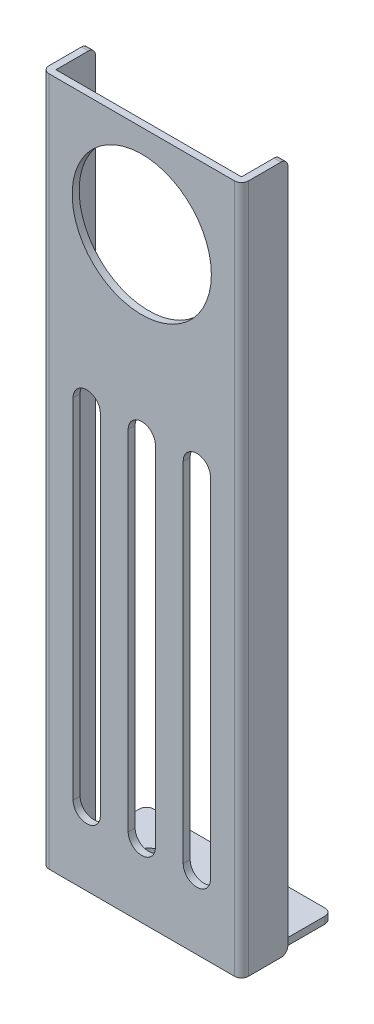
from build123d import *

# Parameters (mm, degrees)
CROQUIS1_W              = 40
CROQUIS1_H              = 148.5
SALIENTE_EXTRUIR1_DEPTH = 1.5
CROQUIS2_R              = 15
CORTAR_EXTRUIR1_DEPTH   = 1.5
CORTAR_EXTRUIR2_DEPTH   = 1.5
CROQUIS4_W              = 10
CROQUIS4_H              = 148.5
SALIENTE_EXTRUIR2_DEPTH = 1.5
CROQUIS5_W              = 10
CROQUIS5_H              = 148.5
SALIENTE_EXTRUIR3_DEPTH = 1.5
REDONDEO1_R             = 1.5
CROQUIS7_W              = 40
CROQUIS7_H              = 21
SALIENTE_EXTRUIR4_DEPTH = 1.5
REDONDEO2_R             = 1.5
CROQUIS8_R              = 2.75
CORTAR_EXTRUIR3_DEPTH   = 1.5
REDONDEO4_R             = 1.5


with BuildPart() as part:
    # Croquis1 → Saliente-Extruir1 (new body)
    with BuildSketch(Plane.XY):
        with Locations((-32.303310274, 45.797728257)):
            Rectangle(CROQUIS1_W, CROQUIS1_H)
    extrude(amount=SALIENTE_EXTRUIR1_DEPTH)

    # Croquis2 → Cortar-Extruir1 (cut)
    with BuildSketch(Plane.XY.offset(1.5)):
        with Locations((-32.303310274, 100.047728257)):
            Circle(CROQUIS2_R)
    extrude(amount=-CORTAR_EXTRUIR1_DEPTH, mode=Mode.SUBTRACT)

    # Croquis3 → Cortar-Extruir2 (cut)
    with BuildSketch(Plane.XY.offset(1.5)):
        with BuildLine():
            Line((-41.236643608, -12.952271743), (-41.236643608, 62.177728257))
            ThreePointArc((-41.236643608, 62.177728257), (-44.169976941, 65.11106159), (-47.103310274, 62.177728257))
            Line((-47.103310274, 62.177728257), (-47.103310274, -12.952271743))
            ThreePointArc((-47.103310274, -12.952271743), (-44.169976941, -15.885605076), (-41.236643608, -12.952271743))
        make_face()
        with BuildLine():
            Line((-29.369976941, -12.952271743), (-29.369976941, 62.177728257))
            ThreePointArc((-29.369976941, 62.177728257), (-32.303310274, 65.11106159), (-35.236643608, 62.177728257))
            Line((-35.236643608, 62.177728257), (-35.236643608, -12.952271743))
            ThreePointArc((-35.236643608, -12.952271743), (-32.303310274, -15.885605076), (-29.369976941, -12.952271743))
        make_face()
        with BuildLine():
            Line((-17.503310274, 62.177728257), (-17.503310274, -12.952271743))
            ThreePointArc((-17.503310274, -12.952271743), (-20.436643608, -15.885605076), (-23.369976941, -12.952271743))
            Line((-23.369976941, -12.952271743), (-23.369976941, 62.177728257))
            ThreePointArc((-23.369976941, 62.177728257), (-20.436643608, 65.11106159), (-17.503310274, 62.177728257))
        make_face()
    extrude(amount=-CORTAR_EXTRUIR2_DEPTH, mode=Mode.SUBTRACT)

    # Croquis4 → Saliente-Extruir2 (add)
    with BuildSketch(Plane.ZY.offset(52.303310274)):
        with Locations((-3.5, 45.797728257)):
            Rectangle(CROQUIS4_W, CROQUIS4_H)
    extrude(amount=SALIENTE_EXTRUIR2_DEPTH)

    # Croquis5 → Saliente-Extruir3 (add)
    with BuildSketch(Plane(origin=(-12.303310274, 0, 0), x_dir=(0, 0, -1), z_dir=(1, 0, 0))):
        with Locations((3.5, 45.797728257)):
            Rectangle(CROQUIS5_W, CROQUIS5_H)
    extrude(amount=SALIENTE_EXTRUIR3_DEPTH)

    # Redondeo1
    redondeo1_edges = [part.edges().sort_by_distance(p)[0] for p in [
        (-53.803310274, 45.797728257, 1.5),
        (-10.803310274, 45.797728257, 1.5),
    ]]
    fillet(redondeo1_edges, radius=REDONDEO1_R)

    # Croquis7 → Saliente-Extruir4 (add)
    with BuildSketch(Plane.XZ.offset(28.452271743)):
        with Locations((-32.303310274, -9)):
            Rectangle(CROQUIS7_W, CROQUIS7_H)
    extrude(amount=-SALIENTE_EXTRUIR4_DEPTH)

    # Redondeo2
    redondeo2_edges = [part.edges().sort_by_distance(p)[0] for p in [
        (-32.303310274, -26.952271743, 0),
    ]]
    fillet(redondeo2_edges, radius=REDONDEO2_R)

    # Croquis8 → Cortar-Extruir3 (cut)
    with BuildSketch(Plane(origin=(0, -28.452271743, 0), x_dir=(-1, 0, 0), z_dir=(0, -1, 0))):
        with Locations(Location((42.053310274, 9.75, 0), (0, 0, 90))):
            Circle(CROQUIS8_R)
        with Locations(Location((22.553310274, 9.75, 0), (0, 0, 90))):
            Circle(CROQUIS8_R)
    extrude(amount=-CORTAR_EXTRUIR3_DEPTH, mode=Mode.SUBTRACT)

    # Redondeo4
    redondeo4_edges = [part.edges().sort_by_distance(p)[0] for p in [
        (-52.303310274, -27.702271743, -19.5),
        (-12.303310274, -27.702271743, -19.5),
        (-53.053310274, -28.452271743, -8.5),
        (-53.053310274, 120.047728257, -8.5),
        (-11.553310274, -28.452271743, -8.5),
        (-11.553310274, 120.047728257, -8.5),
    ]]
    fillet(redondeo4_edges, radius=REDONDEO4_R)


solid = part.part
